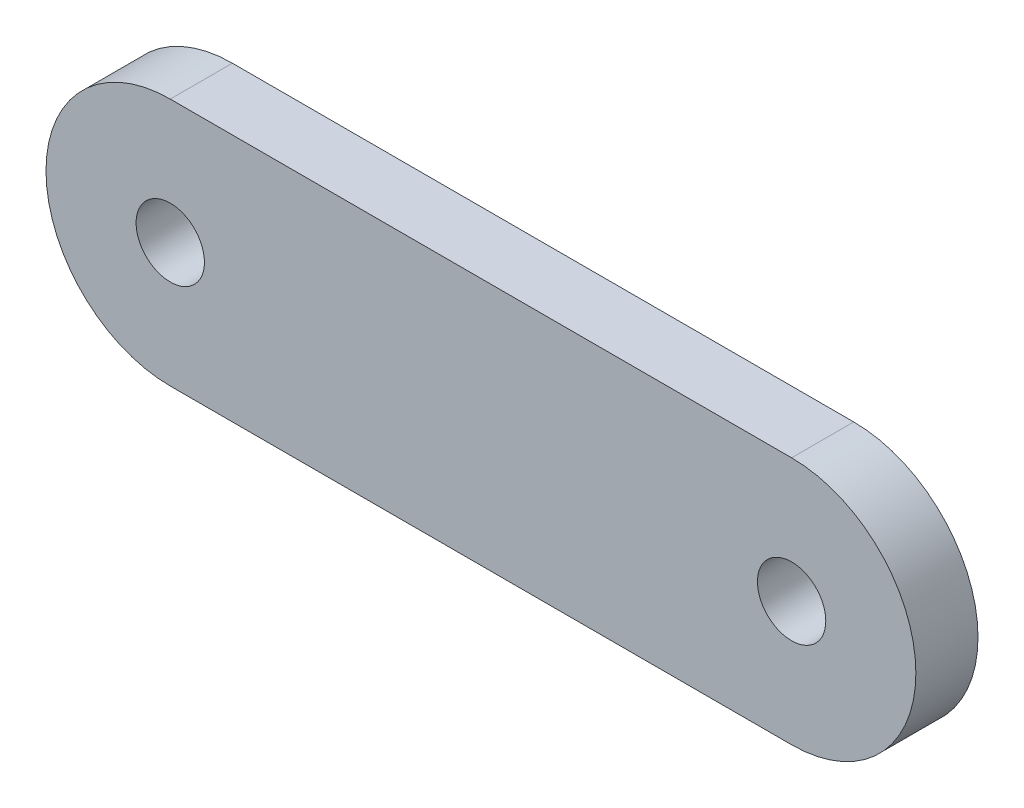
from build123d import *

# Parameters (mm, degrees)
SKETCH1_R           = 5.5
BOSS_EXTRUDE1_DEPTH = 10


with BuildPart() as part:
    # Sketch1 → Boss-Extrude1 (new body)
    with BuildSketch(Plane.XY):
        with BuildLine():
            Line((0, 0), (100, 0))
            ThreePointArc((100, 0), (120, 20), (100, 40))
            Line((100, 40), (0, 40))
            ThreePointArc((0, 40), (-20, 20), (0, 0))
        make_face()
        with Locations((0, 20)):
            Circle(SKETCH1_R, mode=Mode.SUBTRACT)
        with Locations((100, 20)):
            Circle(SKETCH1_R, mode=Mode.SUBTRACT)
    extrude(amount=BOSS_EXTRUDE1_DEPTH)


solid = part.part
